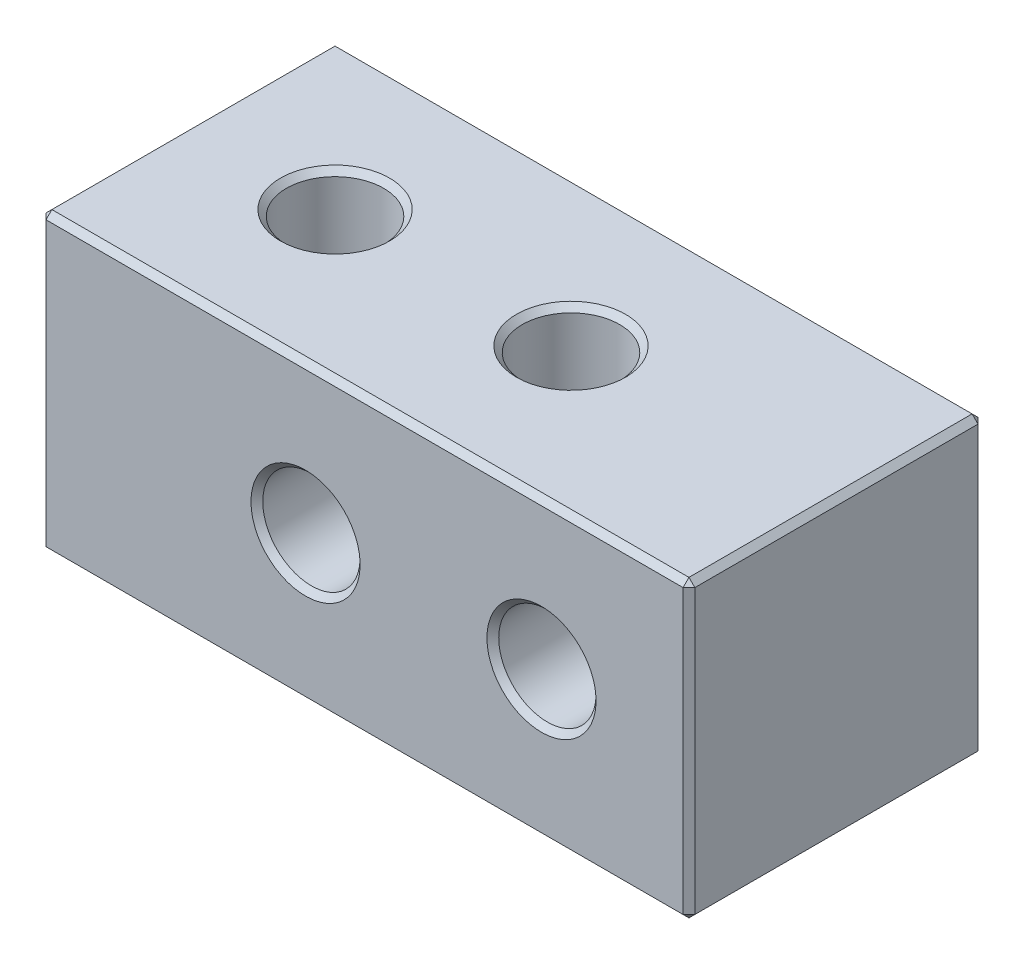
from build123d import *

# Parameters (mm, degrees)
SKETCH_1_W         = 22
SKETCH_1_H         = 10
EXTRUDE_1_DEPTH    = 5
HOLE_WIZARD_M4_1_D = 3.3
HOLE_WIZARD_M4_2_D = 3.3
CHAMFER_1_SIZE     = 0.2


with BuildPart() as part:
    # 草图1 → 凸台-拉伸1 (new, symmetric)
    with BuildSketch(Plane(origin=(0, 0, 0), x_dir=(1, 0, 0), z_dir=(0, 1, 0))):
        Rectangle(SKETCH_1_W, SKETCH_1_H)
    extrude(amount=EXTRUDE_1_DEPTH, both=True)

    # M4 螺纹孔1 (through all)
    with Locations(Plane(origin=(0, 5, 0), x_dir=(1, 0, 0), z_dir=(0, 1, 0))):
        with Locations((-6, 0), (2, 0)):
            Hole(HOLE_WIZARD_M4_1_D / 2)

    # M4 螺纹孔2 (through all)
    with Locations(Plane(origin=(0, 0, -5), x_dir=(-1, 0, 0), z_dir=(0, 0, -1))):
        with Locations((-6, 0), (2, 0)):
            Hole(HOLE_WIZARD_M4_2_D / 2)

    # 倒角1
    chamfer_1_edges = [part.edges().sort_by_distance(p)[0] for p in [
        (-11, 5, 0),
        (3.65, 5, 0),
        (3.65, -5, 0),
        (0, 5, 5),
        (-4.35, 5, 0),
        (-4.35, -5, 0),
        (-3.65, 0, -5),
        (-3.65, 0, 5),
        (4.35, 0, -5),
        (4.35, 0, 5),
        (11, 5, 0),
        (0, -5, 5),
        (-11, -5, 0),
        (0, -5, -5),
        (11, -5, 0),
        (11, 0, 5),
        (-11, 0, 5),
        (-11, 0, -5),
        (11, 0, -5),
        (0, 5, -5),
    ]]
    chamfer(chamfer_1_edges, length=CHAMFER_1_SIZE)


solid = part.part
